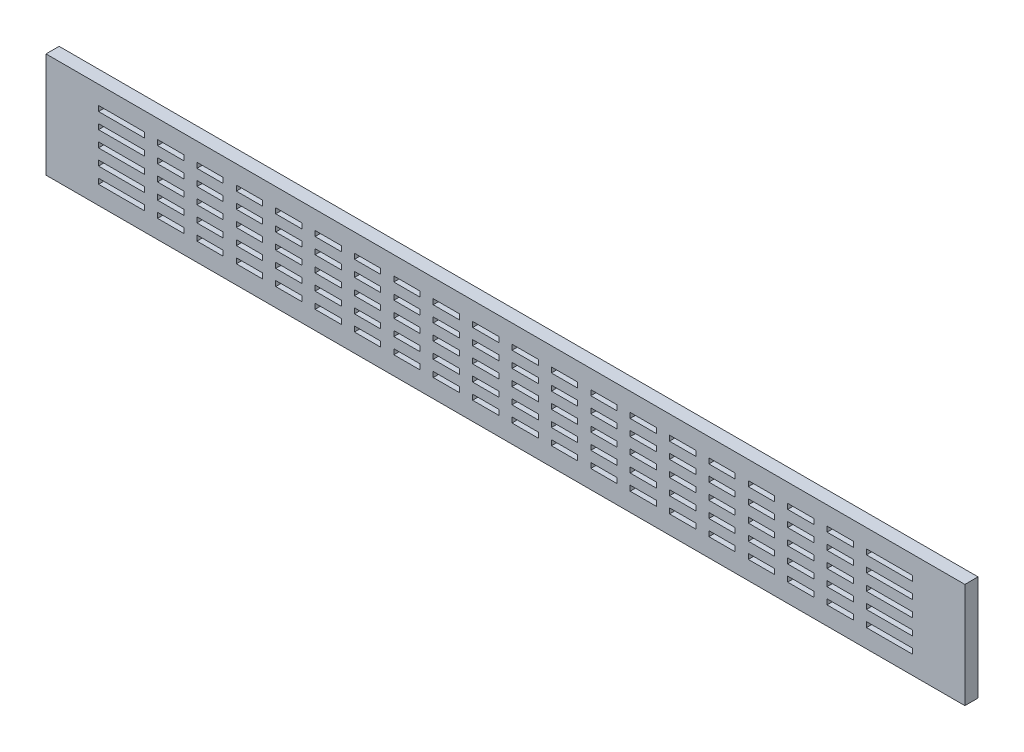
from build123d import *

# Parameters (mm, degrees)
SKETCH_1_W          = 350
SKETCH_1_H          = 40
EXTRUDE_1_DEPTH     = 5
SKETCH_2_W          = 310
SKETCH_2_H          = 2
CUT_EXTRUDE_1_DEPTH = 177.210101867
SKETCH_3_W          = 5
SKETCH_3_H          = 26
EXTRUDE_2_DEPTH     = 5


with BuildPart() as part:
    # 草图1 → 凸台-拉伸1 (new body)
    with BuildSketch(Plane.XY):
        Rectangle(SKETCH_1_W, SKETCH_1_H)
    extrude(amount=EXTRUDE_1_DEPTH)

    # 草图2 → 切除-拉伸1 (cut, through all)
    with BuildSketch(Plane.XY.offset(5)):
        Rectangle(SKETCH_2_W, SKETCH_2_H)
        with Locations((0, -6)):
            Rectangle(SKETCH_2_W, SKETCH_2_H)
        with Locations((0, -12)):
            Rectangle(SKETCH_2_W, SKETCH_2_H)
        with Locations((0, 12)):
            Rectangle(SKETCH_2_W, SKETCH_2_H)
        with Locations((0, 6)):
            Rectangle(SKETCH_2_W, SKETCH_2_H)
    extrude(amount=-CUT_EXTRUDE_1_DEPTH, mode=Mode.SUBTRACT)

    # 草图3 → 凸台-拉伸2 (add)
    with BuildSketch(Plane.XY.offset(5)):
        Rectangle(SKETCH_3_W, SKETCH_3_H)
        with Locations((15, 0)):
            Rectangle(SKETCH_3_W, SKETCH_3_H)
        with Locations((30, 0)):
            Rectangle(SKETCH_3_W, SKETCH_3_H)
        with Locations((45, 0)):
            Rectangle(SKETCH_3_W, SKETCH_3_H)
        with Locations((60, 0)):
            Rectangle(SKETCH_3_W, SKETCH_3_H)
        with Locations((75, 0)):
            Rectangle(SKETCH_3_W, SKETCH_3_H)
        with Locations((90, 0)):
            Rectangle(SKETCH_3_W, SKETCH_3_H)
        with Locations((105, 0)):
            Rectangle(SKETCH_3_W, SKETCH_3_H)
        with Locations((120, 0)):
            Rectangle(SKETCH_3_W, SKETCH_3_H)
        with Locations((135, 0)):
            Rectangle(SKETCH_3_W, SKETCH_3_H)
        with Locations((-135, 0)):
            Rectangle(SKETCH_3_W, SKETCH_3_H)
        with Locations((-120, 0)):
            Rectangle(SKETCH_3_W, SKETCH_3_H)
        with Locations((-105, 0)):
            Rectangle(SKETCH_3_W, SKETCH_3_H)
        with Locations((-90, 0)):
            Rectangle(SKETCH_3_W, SKETCH_3_H)
        with Locations((-75, 0)):
            Rectangle(SKETCH_3_W, SKETCH_3_H)
        with Locations((-60, 0)):
            Rectangle(SKETCH_3_W, SKETCH_3_H)
        with Locations((-45, 0)):
            Rectangle(SKETCH_3_W, SKETCH_3_H)
        with Locations((-30, 0)):
            Rectangle(SKETCH_3_W, SKETCH_3_H)
        with Locations((-15, 0)):
            Rectangle(SKETCH_3_W, SKETCH_3_H)
    extrude(amount=-EXTRUDE_2_DEPTH)


solid = part.part
